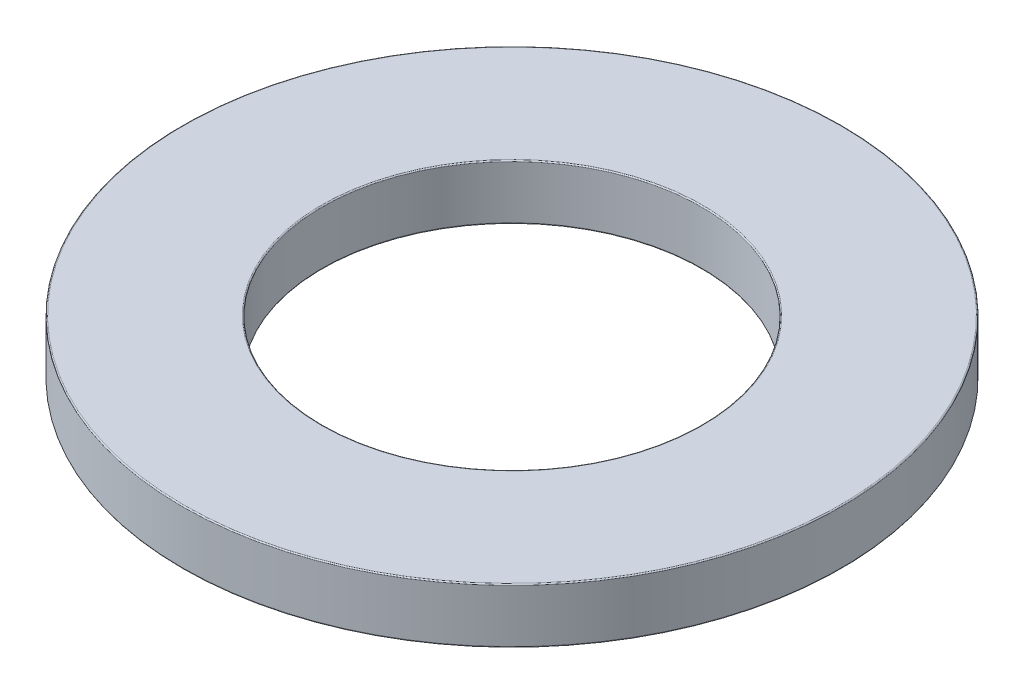
from build123d import *

# Parameters (mm, degrees)
SKETCH3_R           = 4.6355
SKETCH3_R_2         = 2.667
BOSS_EXTRUDE1_DEPTH = 0.38735
FILLET1_R           = 0.015875


with BuildPart() as part:
    # Sketch3 → Boss-Extrude1 (new, symmetric)
    with BuildSketch(Plane(origin=(0, 0, 0), x_dir=(1, 0, 0), z_dir=(0, 1, 0))):
        with Locations(Location((0, 0, 0), (0, 0, 270))):
            Circle(SKETCH3_R)
        with Locations(Location((0, 0, 0), (0, 0, 270))):
            Circle(SKETCH3_R_2, mode=Mode.SUBTRACT)
    extrude(amount=BOSS_EXTRUDE1_DEPTH, both=True)

    # Fillet1
    fillet1_edges = [part.edges().sort_by_distance(p)[0] for p in [
        (0, -0.38735, -4.6355),
        (0, 0.38735, -4.6355),
        (0, -0.38735, -2.667),
        (0, 0.38735, -2.667),
    ]]
    fillet(fillet1_edges, radius=FILLET1_R)


solid = part.part
